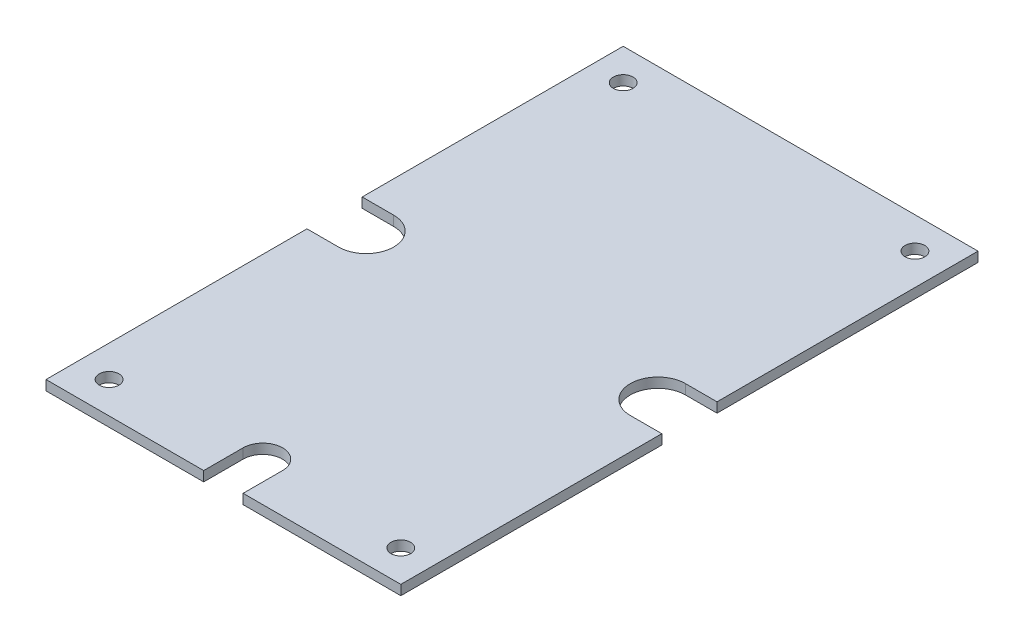
from build123d import *

# Parameters (mm, degrees)
SKETCH1_W           = 57.15
SKETCH1_H           = 92.964
BOSS_EXTRUDE1_DEPTH = 1.5875
SKETCH2_R           = 1.5875
CUT_EXTRUDE1_DEPTH  = 110.137289467
SKETCH3_R           = 4.445
CUT_EXTRUDE2_DEPTH  = 110.137289467
CUT_EXTRUDE3_REACH  = 111.137


with BuildPart() as part:
    # Sketch1 → Boss-Extrude1 (new body)
    with BuildSketch(Plane(origin=(0, 0, 0), x_dir=(1, 0, 0), z_dir=(0, 1, 0))):
        with Locations((28.575, 46.482)):
            Rectangle(SKETCH1_W, SKETCH1_H)
    extrude(amount=BOSS_EXTRUDE1_DEPTH)

    # Sketch2 → Cut-Extrude1 (cut, through all)
    with BuildSketch(Plane(origin=(0, 1.5875, 0), x_dir=(1, 0, 0), z_dir=(0, 1, 0))):
        with Locations(Location((5.08, 87.884, 0), (0, 0, 270))):
            Circle(SKETCH2_R)
        with Locations(Location((52.07, 87.884, 0), (0, 0, 270))):
            Circle(SKETCH2_R)
        with Locations(Location((5.08, 5.08, 0), (0, 0, 270))):
            Circle(SKETCH2_R)
        with Locations(Location((52.07, 5.08, 0), (0, 0, 270))):
            Circle(SKETCH2_R)
    extrude(amount=-CUT_EXTRUDE1_DEPTH, mode=Mode.SUBTRACT)

    # Sketch3 → Cut-Extrude2 (cut, through all)
    with BuildSketch(Plane(origin=(0, 1.5875, 0), x_dir=(1, 0, 0), z_dir=(0, 1, 0))):
        with BuildLine():
            ThreePointArc((56.515, 46.482), (55.213089642, 43.338910358), (52.07, 42.037))
            Line((52.07, 42.037), (57.15, 42.037))
            Line((57.15, 42.037), (57.15, 50.927))
            Line((57.15, 50.927), (52.07, 50.927))
            ThreePointArc((52.07, 50.927), (55.213089642, 49.625089642), (56.515, 46.482))
        make_face()
        with Locations((52.07, 46.482)):
            Circle(SKETCH3_R)
        with Locations((5.08, 46.482)):
            Circle(SKETCH3_R)
        with BuildLine():
            Line((5.08, 50.927), (0, 50.927))
            Line((0, 50.927), (0, 42.037))
            Line((0, 42.037), (5.08, 42.037))
            ThreePointArc((5.08, 42.037), (0.635, 46.482), (5.08, 50.927))
        make_face()
    extrude(amount=-CUT_EXTRUDE2_DEPTH, mode=Mode.SUBTRACT)

    # Sketch4 → Cut-Extrude3 (cut, up to next)
    with BuildSketch(Plane(origin=(0, 1.5875, 0), x_dir=(1, 0, 0), z_dir=(0, 1, 0)), mode=Mode.PRIVATE) as cut_extrude3_sk1:
        with BuildLine():
            ThreePointArc((28.575, 3.175), (30.82006403, 4.10493597), (31.75, 6.35))
            ThreePointArc((31.75, 6.35), (30.82006403, 8.59506403), (28.575, 9.525))
            Line((28.575, 9.525), (28.575, 3.175))
        make_face()
    cut_extrude3_tool1 = extrude(cut_extrude3_sk1.sketch, amount=-CUT_EXTRUDE3_REACH, mode=Mode.PRIVATE) & part.part
    # Sketch4 → Cut-Extrude3 (cut, up to next)
    with BuildSketch(Plane(origin=(0, 1.5875, 0), x_dir=(1, 0, 0), z_dir=(0, 1, 0)), mode=Mode.PRIVATE) as cut_extrude3_sk2:
        with BuildLine():
            Line((28.575, 3.175), (28.575, 9.525))
            ThreePointArc((28.575, 9.525), (26.32993597, 8.59506403), (25.4, 6.35))
            ThreePointArc((25.4, 6.35), (26.32993597, 4.10493597), (28.575, 3.175))
        make_face()
    cut_extrude3_tool2 = extrude(cut_extrude3_sk2.sketch, amount=-CUT_EXTRUDE3_REACH, mode=Mode.PRIVATE) & part.part
    # Sketch4 → Cut-Extrude3 (cut, up to next)
    with BuildSketch(Plane(origin=(0, 1.5875, 0), x_dir=(1, 0, 0), z_dir=(0, 1, 0)), mode=Mode.PRIVATE) as cut_extrude3_sk3:
        with BuildLine():
            ThreePointArc((28.575, 3.175), (30.82006403, 4.10493597), (31.75, 6.35))
            ThreePointArc((31.75, 6.35), (30.82006403, 8.59506403), (28.575, 9.525))
            Line((28.575, 9.525), (28.575, 3.175))
        make_face()
    cut_extrude3_tool3 = extrude(cut_extrude3_sk3.sketch, amount=-CUT_EXTRUDE3_REACH, mode=Mode.PRIVATE) & part.part
    # Sketch4 → Cut-Extrude3 (cut, up to next)
    with BuildSketch(Plane(origin=(0, 1.5875, 0), x_dir=(1, 0, 0), z_dir=(0, 1, 0)), mode=Mode.PRIVATE) as cut_extrude3_sk4:
        with BuildLine():
            Line((28.575, 3.175), (28.575, 9.525))
            ThreePointArc((28.575, 9.525), (26.32993597, 8.59506403), (25.4, 6.35))
            ThreePointArc((25.4, 6.35), (26.32993597, 4.10493597), (28.575, 3.175))
        make_face()
    cut_extrude3_tool4 = extrude(cut_extrude3_sk4.sketch, amount=-CUT_EXTRUDE3_REACH, mode=Mode.PRIVATE) & part.part
    # Sketch4 → Cut-Extrude3 (cut, up to next)
    with BuildSketch(Plane(origin=(0, 1.5875, 0), x_dir=(1, 0, 0), z_dir=(0, 1, 0)), mode=Mode.PRIVATE) as cut_extrude3_sk5:
        with BuildLine():
            Line((28.575, 0), (28.575, 3.175))
            ThreePointArc((28.575, 3.175), (26.32993597, 4.10493597), (25.4, 6.35))
            Line((25.4, 6.35), (25.4, 0))
            Line((25.4, 0), (28.575, 0))
        make_face()
    cut_extrude3_tool5 = extrude(cut_extrude3_sk5.sketch, amount=-CUT_EXTRUDE3_REACH, mode=Mode.PRIVATE) & part.part
    # Sketch4 → Cut-Extrude3 (cut, up to next)
    with BuildSketch(Plane(origin=(0, 1.5875, 0), x_dir=(1, 0, 0), z_dir=(0, 1, 0)), mode=Mode.PRIVATE) as cut_extrude3_sk6:
        with BuildLine():
            Line((31.75, 0), (31.75, 6.35))
            ThreePointArc((31.75, 6.35), (30.82006403, 4.10493597), (28.575, 3.175))
            Line((28.575, 3.175), (28.575, 0))
            Line((28.575, 0), (31.75, 0))
        make_face()
    cut_extrude3_tool6 = extrude(cut_extrude3_sk6.sketch, amount=-CUT_EXTRUDE3_REACH, mode=Mode.PRIVATE) & part.part
    add(cut_extrude3_tool1.solids().sort_by_distance((29.922512, 1.5875, -6.35))[0], mode=Mode.SUBTRACT)
    add(cut_extrude3_tool2.solids().sort_by_distance((27.227488, 1.5875, -6.35))[0], mode=Mode.SUBTRACT)
    add(cut_extrude3_tool3.solids().sort_by_distance((29.922512, 1.5875, -6.35))[0], mode=Mode.SUBTRACT)
    add(cut_extrude3_tool4.solids().sort_by_distance((27.227488, 1.5875, -6.35))[0], mode=Mode.SUBTRACT)
    add(cut_extrude3_tool5.solids().sort_by_distance((26.832316, 1.5875, -1.993291))[0], mode=Mode.SUBTRACT)
    add(cut_extrude3_tool6.solids().sort_by_distance((30.317684, 1.5875, -1.993291))[0], mode=Mode.SUBTRACT)


solid = part.part
